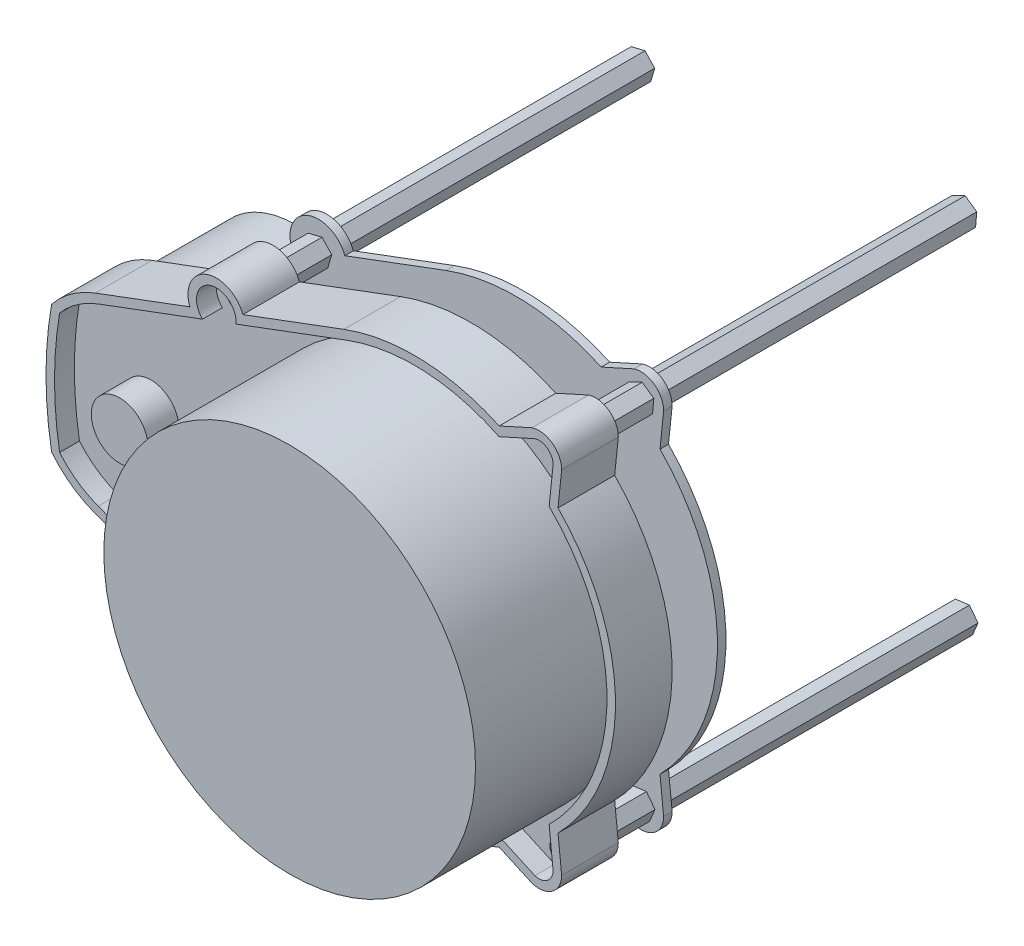
from build123d import *

# Parameters (mm, degrees)
ESQUISSE1_R             = 1.6
BOSS_EXTRU_1_DEPTH      = 10
ESQUISSE2_R             = 32.8
BOSS_EXTRU_2_DEPTH      = 22
ENL_V_MAT_EXTRU_1_DEPTH = 3.5
BOSS_EXTRU_3_REACH      = 79.261
ESQUISSE4_R             = 32.8
ESQUISSE5_R             = 16
BOSS_EXTRU_4_DEPTH      = 19
ESQUISSE6_R             = 1
BOSS_EXTRU_5_DEPTH      = 65
BOSS_EXTRU_6_DEPTH      = 1.5
ESQUISSE8_R             = 5
BOSS_EXTRU_7_DEPTH      = 5.5


with BuildPart() as part:
    # Esquisse1 → Boss.-Extru.1 (new body)
    with BuildSketch(Plane.XY):
        with BuildLine():
            ThreePointArc((-56.3, -16.861494596), (-60.528670487, -14.599558136), (-64.01, -11.301322931))
            ThreePointArc((-64.01, -11.301322931), (-65, 0), (-64.01, 11.301322931))
            ThreePointArc((-64.01, 11.301322931), (-60.528670487, 14.599558136), (-56.3, 16.861494596))
            Line((-56.3, 16.861494596), (-39.624688626, 23.091930519))
            ThreePointArc((-39.624688626, 23.091930519), (-36.690940127, 29.525679018), (-30.257191628, 26.591930519))
            Line((-30.257191628, 26.591930519), (-12.425, 33.254614341))
            ThreePointArc((-12.425, 33.254614341), (1.381675102, 35.473102119), (14.973963383, 32.187426436))
            Line((14.973963383, 32.187426436), (20.756023105, 34.801647207))
            ThreePointArc((20.756023105, 34.801647207), (24.347774736, 34.238511045), (26, 31))
            Line((26, 31), (25.359978077, 24.841930519))
            ThreePointArc((25.359978077, 24.841930519), (35.5, 0), (25.359978077, -24.841930519))
            Line((25.359978077, -24.841930519), (26, -31))
            ThreePointArc((26, -31), (24.347774736, -34.238511045), (20.756023105, -34.801647207))
            Line((20.756023105, -34.801647207), (14.973963383, -32.187426436))
            ThreePointArc((14.973963383, -32.187426436), (1.381675102, -35.473102119), (-12.425, -33.254614341))
            Line((-12.425, -33.254614341), (-30.257191628, -26.591930519))
            ThreePointArc((-30.257191628, -26.591930519), (-36.690940127, -29.525679018), (-39.624688626, -23.091930519))
            Line((-39.624688626, -23.091930519), (-56.3, -16.861494596))
        make_face()
        with Locations((-35, -25)):
            Circle(ESQUISSE1_R, mode=Mode.SUBTRACT)
        with Locations((22, 31)):
            Circle(ESQUISSE1_R, mode=Mode.SUBTRACT)
        with Locations((-35, 25)):
            Circle(ESQUISSE1_R, mode=Mode.SUBTRACT)
        with Locations((22, -31)):
            Circle(ESQUISSE1_R, mode=Mode.SUBTRACT)
    extrude(amount=BOSS_EXTRU_1_DEPTH)

    # Esquisse2 → Boss.-Extru.2 (add)
    with BuildSketch(Plane.XY.offset(10)):
        Circle(ESQUISSE2_R)
    extrude(amount=BOSS_EXTRU_2_DEPTH)

    # Esquisse3 → Enlèv. mat.-Extru.1 (cut)
    with BuildSketch(Plane.XY.offset(10)):
        with BuildLine():
            Line((-55.775, -15.456370046), (-37.378202776, -22.330008789))
            ThreePointArc((-37.378202776, -22.330008789), (-36.165940127, -28.120554469), (-31.453677478, -24.543603151))
            Line((-31.453677478, -24.543603151), (-11.9, -31.849489792))
            ThreePointArc((-11.9, -31.849489792), (1.664031028, -33.959255009), (14.956816294, -30.533484019))
            Line((14.956816294, -30.533484019), (21.291141631, -33.397398551))
            ThreePointArc((21.291141631, -33.397398551), (23.468656713, -33.023128137), (24.499056843, -31.06866508))
            Line((24.499056843, -31.06866508), (23.79417774, -24.286562245))
            ThreePointArc((23.79417774, -24.286562245), (34, 0), (23.79417774, 24.286562245))
            Line((23.79417774, 24.286562245), (24.499056843, 31.06866508))
            ThreePointArc((24.499056843, 31.06866508), (23.468656713, 33.023128137), (21.291141631, 33.397398551))
            Line((21.291141631, 33.397398551), (14.956816294, 30.533484019))
            ThreePointArc((14.956816294, 30.533484019), (1.664031028, 33.959255009), (-11.9, 31.849489792))
            Line((-11.9, 31.849489792), (-31.453677478, 24.543603151))
            ThreePointArc((-31.453677478, 24.543603151), (-36.165940127, 28.120554469), (-37.378202776, 22.330008789))
            Line((-37.378202776, 22.330008789), (-55.775, 15.456370046))
            ThreePointArc((-55.775, 15.456370046), (-59.496201473, 13.493411636), (-62.6, 10.653168543))
            ThreePointArc((-62.6, 10.653168543), (-63.5, 0), (-62.6, -10.653168543))
            ThreePointArc((-62.6, -10.653168543), (-59.496201473, -13.493411636), (-55.775, -15.456370046))
        make_face()
    extrude(amount=-ENL_V_MAT_EXTRU_1_DEPTH, mode=Mode.SUBTRACT)


with BuildPart() as enl_v_mat_extru_1_piece_1:
    # of the separate pieces the step leaves, piece 1, a body of its own (enl_v_mat_extru_1_pieces)
    add(part.part.solids().sort_by_distance((32.8, 0, 10))[0])


with BuildPart() as enl_v_mat_extru_1_piece_2:
    # of the separate pieces the step leaves, piece 2, a body of its own (enl_v_mat_extru_1_pieces)
    add(part.part.solids().sort_by_distance((-64.01, 11.301322931, 0))[0])

    # Esquisse4 → Boss.-Extru.3 (add, up to next)
    with BuildSketch(Plane(origin=(0, 0, 10), x_dir=(-1, 0, 0), z_dir=(0, 0, -1)), mode=Mode.PRIVATE) as boss_extru_3_sk1:
        with Locations(Location((0, 0, 0), (0, 0, 180))):
            Circle(ESQUISSE4_R)
    boss_extru_3_tool1 = extrude(boss_extru_3_sk1.sketch, amount=BOSS_EXTRU_3_REACH, mode=Mode.PRIVATE) - enl_v_mat_extru_1_piece_2.part

    add(enl_v_mat_extru_1_piece_1.part)  # Boss.-Extru.3 merges Enlèv. mat.-Extru.1 piece 1
    add(boss_extru_3_tool1.solids().sort_by_distance((0, 0, 10))[0])

    # Esquisse5 → Boss.-Extru.4 (add)
    with BuildSketch(Plane(origin=(0, 0, 0), x_dir=(-1, 0, 0), z_dir=(0, 0, -1))):
        with Locations(Location((50, 0, 0), (0, 0, 336.653490915))):
            Circle(ESQUISSE5_R)
    extrude(amount=BOSS_EXTRU_4_DEPTH)

    # Esquisse6 → Boss.-Extru.5 (add)
    # profile 1 of 4: a face of its own
    with BuildSketch(Plane(origin=(0, 0, 0), x_dir=(-1, 0, 0), z_dir=(0, 0, -1))):
        Polygon((-20.489225606, -29.008126327), (-22.969626005, -28.695694159), (-24.480400399, -30.687567832), (-23.510774394, -32.991873673), (-21.030373995, -33.304305841), (-19.519599601, -31.312432168), align=None)
        with Locations((-22, -31)):
            Circle(ESQUISSE6_R, mode=Mode.SUBTRACT)
    # profile 2 of 4: a face of its own
    with BuildSketch(Plane(origin=(0, 0, 0), x_dir=(-1, 0, 0), z_dir=(0, 0, -1))):
        Polygon((36.086835018, -22.748602735), (33.593650283, -22.933074633), (32.506815266, -25.184471898), (33.913164982, -27.251397265), (36.406349717, -27.066925367), (37.493184734, -24.815528102), align=None)
        with Locations((35, -25)):
            Circle(ESQUISSE6_R, mode=Mode.SUBTRACT)
    # profile 3 of 4: a face of its own
    with BuildSketch(Plane(origin=(0, 0, 0), x_dir=(-1, 0, 0), z_dir=(0, 0, -1))):
        Polygon((36.720274889, 26.814016072), (34.289153443, 27.396809791), (32.568878555, 25.582793719), (33.279725111, 23.185983928), (35.710846557, 22.603190209), (37.431121445, 24.417206281), align=None)
        with Locations((35, 25)):
            Circle(ESQUISSE6_R, mode=Mode.SUBTRACT)
    # profile 4 of 4: a face of its own
    with BuildSketch(Plane(origin=(0, 0, 0), x_dir=(-1, 0, 0), z_dir=(0, 0, -1))):
        Polygon((-19.952160425, 32.43399898), (-22.217959758, 33.490480585), (-24.265799333, 32.056481605), (-24.047839575, 29.56600102), (-21.782040242, 28.509519415), (-19.734200667, 29.943518395), align=None)
        with Locations((-22, 31)):
            Circle(ESQUISSE6_R, mode=Mode.SUBTRACT)
    extrude(amount=BOSS_EXTRU_5_DEPTH)

    # Esquisse7 → Boss.-Extru.6 (add)
    with BuildSketch(Plane(origin=(0, 0, -8), x_dir=(-1, 0, 0), z_dir=(0, 0, -1))):
        with BuildLine():
            Line((30.257191628, 26.591930519), (12.425, 33.254614341))
            ThreePointArc((12.425, 33.254614341), (-1.381675102, 35.473102119), (-14.973963383, 32.187426436))
            Line((-14.973963383, 32.187426436), (-20.756023105, 34.801647207))
            ThreePointArc((-20.756023105, 34.801647207), (-24.347774736, 34.238511045), (-26, 31))
            Line((-26, 31), (-25.359978077, 24.841930519))
            ThreePointArc((-25.359978077, 24.841930519), (-35.5, 0), (-25.359978077, -24.841930519))
            Line((-25.359978077, -24.841930519), (-26, -31))
            ThreePointArc((-26, -31), (-24.347774736, -34.238511045), (-20.756023105, -34.801647207))
            Line((-20.756023105, -34.801647207), (-14.973963383, -32.187426436))
            ThreePointArc((-14.973963383, -32.187426436), (-1.381675102, -35.473102119), (12.425, -33.254614341))
            Line((12.425, -33.254614341), (30.257191628, -26.591930519))
            ThreePointArc((30.257191628, -26.591930519), (36.690940127, -29.525679018), (39.624688626, -23.091930519))
            ThreePointArc((39.624688626, -23.091930519), (33.487603548, 0), (39.624688626, 23.091930519))
            ThreePointArc((39.624688626, 23.091930519), (36.690940127, 29.525679018), (30.257191628, 26.591930519))
        make_face()
    extrude(amount=BOSS_EXTRU_6_DEPTH)

    # Esquisse8 → Boss.-Extru.7 (add)
    with BuildSketch(Plane.XY.offset(6.5)):
        with Locations((-50, 0)):
            Circle(ESQUISSE8_R)
    extrude(amount=BOSS_EXTRU_7_DEPTH)


solid = enl_v_mat_extru_1_piece_2.part
